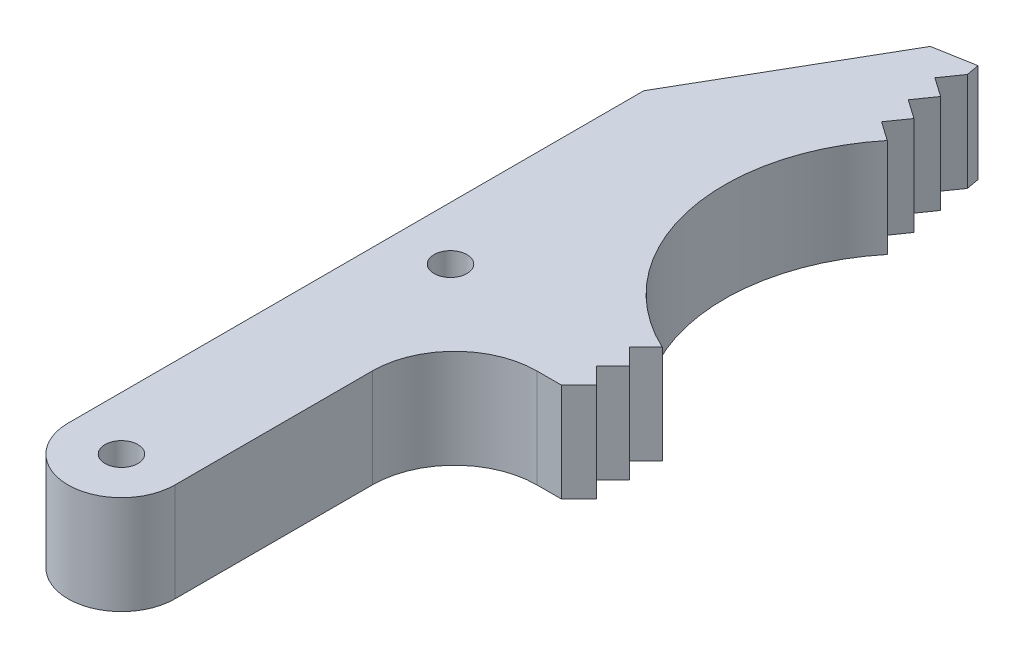
from build123d import *

# Parameters (mm, degrees)
CROQUIS2_R              = 2
SALIENTE_EXTRUIR1_DEPTH = 12
SKETCH1_R               = 2
CUT_EXTRUDE1_DEPTH      = 97.1849006


with BuildPart() as part:
    # Croquis2 → Saliente-Extruir1 (new body)
    with BuildSketch(Plane(origin=(0, 0, 0), x_dir=(1, 0, 0), z_dir=(0, 1, 0))):
        with BuildLine():
            Line((-6.5, 70), (-6.5, 0))
            ThreePointArc((-6.5, 0), (0, -6.5), (6.5, 0))
            Line((6.5, 0), (6.5, 24))
            ThreePointArc((6.5, 24), (9.428932188, 31.071067812), (16.5, 34))
            Line((16.5, 34), (19.5, 34))
            Line((19.5, 34), (21.621320344, 36.121320344))
            Line((21.621320344, 36.121320344), (19.621320344, 38.121320344))
            Line((19.621320344, 38.121320344), (21.621320344, 40.121320344))
            Line((21.621320344, 40.121320344), (19.621320344, 42.121320344))
            Line((19.621320344, 42.121320344), (21.621320344, 44.121320344))
            ThreePointArc((21.621320344, 44.121320344), (8.897927721, 59.859277281), (13.535653981, 79.558503244))
            Line((13.535653981, 79.558503244), (11.21874212, 81.180822395))
            Line((11.21874212, 81.180822395), (12.841061271, 83.497734256))
            Line((12.841061271, 83.497734256), (10.524149409, 85.120053407))
            Line((10.524149409, 85.120053407), (12.14646856, 87.436965268))
            Line((12.14646856, 87.436965268), (9.829556699, 89.059284419))
            Line((9.829556699, 89.059284419), (11.451875849, 91.37619628))
            Line((11.451875849, 91.37619628), (11.174038765, 92.951888685))
            Line((11.174038765, 92.951888685), (6.25, 92.083647797))
            Line((6.25, 92.083647797), (-6.5, 70))
        make_face()
        with Locations(Location((0, 0, 0), (0, 0, 270))):
            Circle(CROQUIS2_R, mode=Mode.SUBTRACT)
    extrude(amount=SALIENTE_EXTRUIR1_DEPTH)

    # Sketch1 → Cut-Extrude1 (cut, through all)
    with BuildSketch(Plane(origin=(0, 12, 0), x_dir=(1, 0, 0), z_dir=(0, 1, 0))):
        with Locations(Location((0, 40, 0), (0, 0, 270))):
            Circle(SKETCH1_R)
    extrude(amount=-CUT_EXTRUDE1_DEPTH, mode=Mode.SUBTRACT)


solid = part.part
